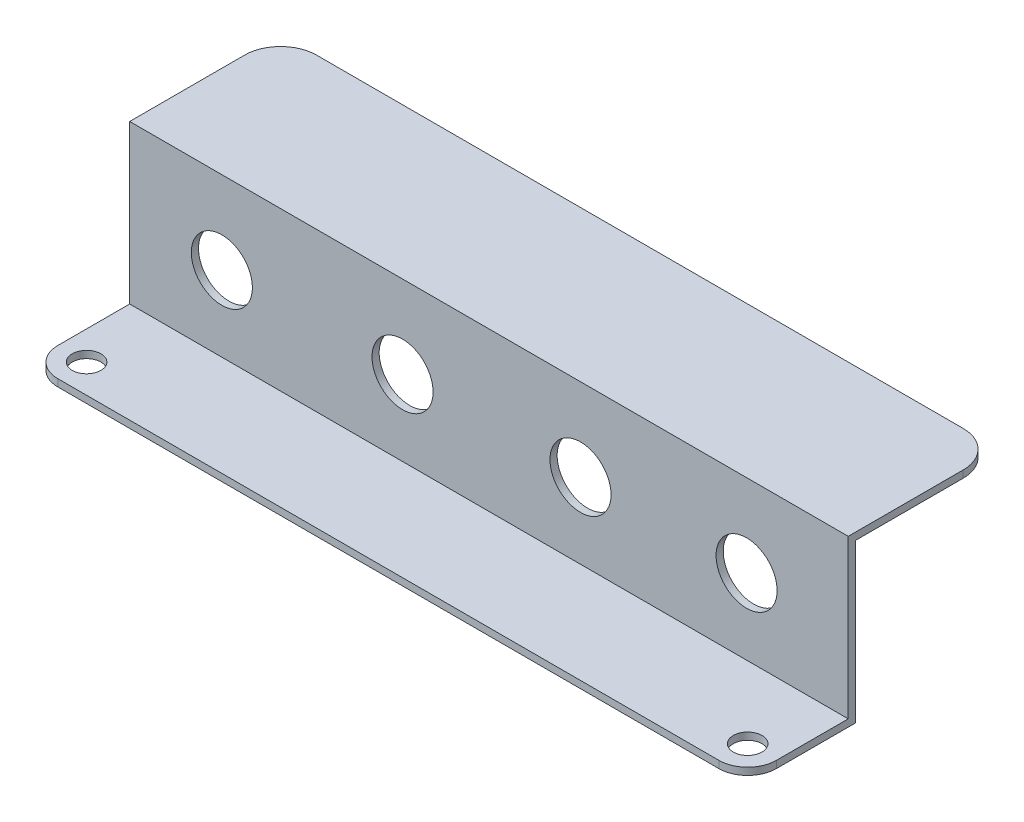
from build123d import *

# Parameters (mm, degrees)
SKETCH1_W           = 100
SKETCH1_H           = 20
BOSS_EXTRUDE1_DEPTH = 1
SKETCH3_W           = 100
SKETCH3_H           = 23
BOSS_EXTRUDE2_DEPTH = 1
SKETCH4_W           = 100
SKETCH4_H           = 14
SKETCH4_R           = 2
BOSS_EXTRUDE3_DEPTH = 1
FILLET1_R           = 4
CUT_EXTRUDE2_REACH  = 60.523
SKETCH6_R           = 4.25
FILLET2_R           = 5


with BuildPart() as part:
    # Sketch1 → Boss-Extrude1 (new body)
    with BuildSketch(Plane(origin=(0, 0, 0), x_dir=(1, 0, 0), z_dir=(0, 1, 0))):
        Rectangle(SKETCH1_W, SKETCH1_H)
    extrude(amount=BOSS_EXTRUDE1_DEPTH)

    # Sketch3 → Boss-Extrude2 (add)
    with BuildSketch(Plane.XY.offset(10)):
        with Locations((0, -10.5)):
            Rectangle(SKETCH3_W, SKETCH3_H)
    extrude(amount=BOSS_EXTRUDE2_DEPTH)

    # Sketch4 → Boss-Extrude3 (add)
    with BuildSketch(Plane.XZ.offset(22)):
        with Locations((0, 18)):
            Rectangle(SKETCH4_W, SKETCH4_H)
        with Locations(Location((46, 21, 0), (0, 0, 270))):
            Circle(SKETCH4_R, mode=Mode.SUBTRACT)
        with Locations(Location((-46, 21, 0), (0, 0, 270))):
            Circle(SKETCH4_R, mode=Mode.SUBTRACT)
    extrude(amount=-BOSS_EXTRUDE3_DEPTH)

    # Fillet1
    fillet1_edges = [part.edges().sort_by_distance(p)[0] for p in [
        (-50, -21.5, 25),
        (50, -21.5, 25),
    ]]
    fillet(fillet1_edges, radius=FILLET1_R)

    # Sketch6 → Cut-Extrude2 (cut, up to next)
    with BuildSketch(Plane.XY.offset(11), mode=Mode.PRIVATE) as cut_extrude2_sk1:
        with Locations((-37.172974346, -10.5)):
            Circle(SKETCH6_R)
    cut_extrude2_tool1 = extrude(cut_extrude2_sk1.sketch, amount=-CUT_EXTRUDE2_REACH, mode=Mode.PRIVATE) & part.part
    # Sketch6 → Cut-Extrude2 (cut, up to next)
    with BuildSketch(Plane.XY.offset(11), mode=Mode.PRIVATE) as cut_extrude2_sk2:
        with Locations((-12.026924054, -10.5)):
            Circle(SKETCH6_R)
    cut_extrude2_tool2 = extrude(cut_extrude2_sk2.sketch, amount=-CUT_EXTRUDE2_REACH, mode=Mode.PRIVATE) & part.part
    # Sketch6 → Cut-Extrude2 (cut, up to next)
    with BuildSketch(Plane.XY.offset(11), mode=Mode.PRIVATE) as cut_extrude2_sk3:
        with Locations((12.738125476, -10.5)):
            Circle(SKETCH6_R)
    cut_extrude2_tool3 = extrude(cut_extrude2_sk3.sketch, amount=-CUT_EXTRUDE2_REACH, mode=Mode.PRIVATE) & part.part
    # Sketch6 → Cut-Extrude2 (cut, up to next)
    with BuildSketch(Plane.XY.offset(11), mode=Mode.PRIVATE) as cut_extrude2_sk4:
        with Locations((35.852171704, -10.5)):
            Circle(SKETCH6_R)
    cut_extrude2_tool4 = extrude(cut_extrude2_sk4.sketch, amount=-CUT_EXTRUDE2_REACH, mode=Mode.PRIVATE) & part.part
    add(cut_extrude2_tool1.solids().sort_by_distance((-37.172974, -10.5, 11))[0], mode=Mode.SUBTRACT)
    add(cut_extrude2_tool2.solids().sort_by_distance((-12.026924, -10.5, 11))[0], mode=Mode.SUBTRACT)
    add(cut_extrude2_tool3.solids().sort_by_distance((12.738125, -10.5, 11))[0], mode=Mode.SUBTRACT)
    add(cut_extrude2_tool4.solids().sort_by_distance((35.852172, -10.5, 11))[0], mode=Mode.SUBTRACT)

    # Fillet2
    fillet2_edges = [part.edges().sort_by_distance(p)[0] for p in [
        (-50, 0.5, -10),
        (50, 0.5, -10),
    ]]
    fillet(fillet2_edges, radius=FILLET2_R)


solid = part.part
